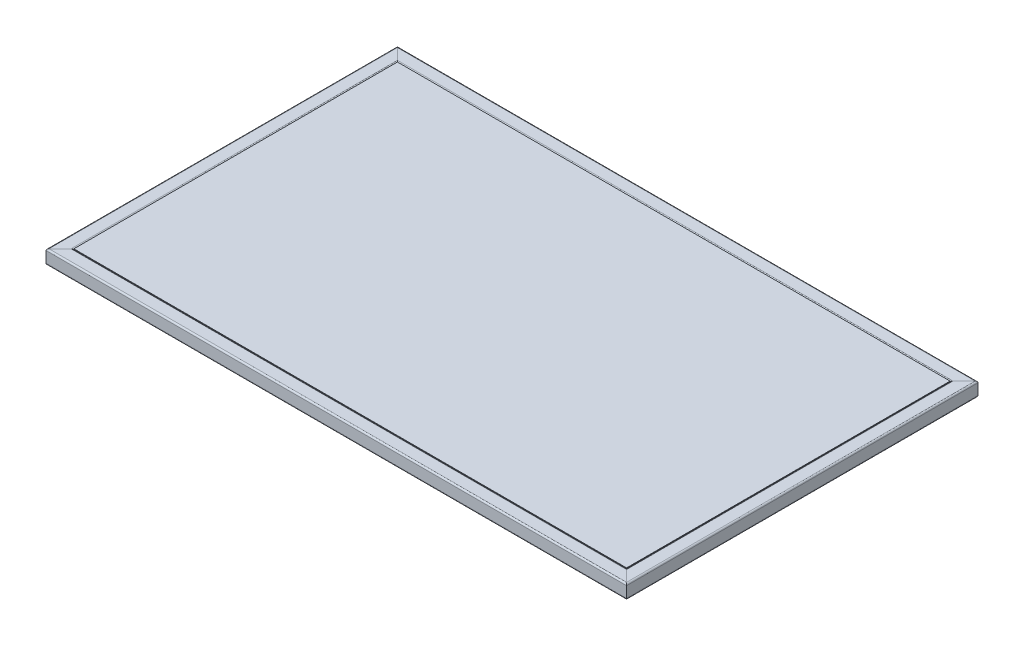
from build123d import *

# Parameters (mm, degrees)
TUBO_CUADRADO_2_X_2_X_0_25_1_DEPTH      = 507.940768363
TUBO_CUADRADO_2_X_2_X_0_25_1_DEPTH_BACK = 27.940768363
TUBO_CUADRADO_2_X_2_X_0_25_1_2_DEPTH    = 848.881536726
TUBO_CUADRADO_2_X_2_X_0_25_1_3_DEPTH    = 535.881536726
TUBO_CUADRADO_2_X_2_X_0_25_1_4_DEPTH    = 848.881536726
CROQUIS2_W                              = 754.9
CROQUIS2_H                              = 441.9
SALIENTE_EXTRUIR1_DEPTH                 = 12.7
VACIADO1_T                              = -1.9


with BuildPart() as part:
    # Sketch1 → Tubo cuadrado 2 X 2 X 0.25(1) (new, two sides: drawn at the far end of the back side and taken through both)
    with BuildSketch(Plane(origin=(-386.975, 9.525, -240), x_dir=(1, 0, 0), z_dir=(0, 0, 1)).offset(-TUBO_CUADRADO_2_X_2_X_0_25_1_DEPTH_BACK)):
        with BuildLine():
            Line((-7.525, -9.525), (7.525, -9.525))
            ThreePointArc((7.525, -9.525), (8.939213562, -8.939213562), (9.525, -7.525))
            Line((9.525, -7.525), (9.525, 7.525))
            ThreePointArc((9.525, 7.525), (8.939213562, 8.939213562), (7.525, 9.525))
            Line((7.525, 9.525), (-7.525, 9.525))
            ThreePointArc((-7.525, 9.525), (-8.939213562, 8.939213562), (-9.525, 7.525))
            Line((-9.525, 7.525), (-9.525, -7.525))
            ThreePointArc((-9.525, -7.525), (-8.939213562, -8.939213562), (-7.525, -9.525))
        make_face()
        with BuildLine():
            Line((-7.525, -8.525), (7.525, -8.525))
            ThreePointArc((7.525, -8.525), (8.232106781, -8.232106781), (8.525, -7.525))
            Line((8.525, -7.525), (8.525, 7.525))
            ThreePointArc((8.525, 7.525), (8.232106781, 8.232106781), (7.525, 8.525))
            Line((7.525, 8.525), (-7.525, 8.525))
            ThreePointArc((-7.525, 8.525), (-8.232106781, 8.232106781), (-8.525, 7.525))
            Line((-8.525, 7.525), (-8.525, -7.525))
            ThreePointArc((-8.525, -7.525), (-8.232106781, -8.232106781), (-7.525, -8.525))
        make_face(mode=Mode.SUBTRACT)
    extrude(amount=TUBO_CUADRADO_2_X_2_X_0_25_1_DEPTH + TUBO_CUADRADO_2_X_2_X_0_25_1_DEPTH_BACK)

    # Tubo cuadrado 2 X 2 X 0.25(1) mitre 1
    split(bisect_by=Plane(origin=(-396.5, 0, -240), x_dir=(0, -1, 0), z_dir=(-0.707106781, 0, 0.707106781)), keep=Keep.TOP)

    # Tubo cuadrado 2 X 2 X 0.25(1) mitre 2
    split(bisect_by=Plane(origin=(-396.5, 0, 240), x_dir=(0, -1, 0), z_dir=(-0.707106781, 0, -0.707106781)), keep=Keep.TOP)


with BuildPart() as body_2:
    # Sketch1 on segment 2 (carried to segment 2) → Tubo cuadrado 2 X 2 X 0.25_1 2 (new body)
    with BuildSketch(Plane(origin=(-424.440768363, 9.525, 230.475), x_dir=(0, 0, -1), z_dir=(1, 0, 0))):
        with BuildLine():
            Line((-7.525, -9.525), (7.525, -9.525))
            ThreePointArc((7.525, -9.525), (8.939213562, -8.939213562), (9.525, -7.525))
            Line((9.525, -7.525), (9.525, 7.525))
            ThreePointArc((9.525, 7.525), (8.939213562, 8.939213562), (7.525, 9.525))
            Line((7.525, 9.525), (-7.525, 9.525))
            ThreePointArc((-7.525, 9.525), (-8.939213562, 8.939213562), (-9.525, 7.525))
            Line((-9.525, 7.525), (-9.525, -7.525))
            ThreePointArc((-9.525, -7.525), (-8.939213562, -8.939213562), (-7.525, -9.525))
        make_face()
        with BuildLine():
            Line((-7.525, -8.525), (7.525, -8.525))
            ThreePointArc((7.525, -8.525), (8.232106781, -8.232106781), (8.525, -7.525))
            Line((8.525, -7.525), (8.525, 7.525))
            ThreePointArc((8.525, 7.525), (8.232106781, 8.232106781), (7.525, 8.525))
            Line((7.525, 8.525), (-7.525, 8.525))
            ThreePointArc((-7.525, 8.525), (-8.232106781, 8.232106781), (-8.525, 7.525))
            Line((-8.525, 7.525), (-8.525, -7.525))
            ThreePointArc((-8.525, -7.525), (-8.232106781, -8.232106781), (-7.525, -8.525))
        make_face(mode=Mode.SUBTRACT)
    extrude(amount=TUBO_CUADRADO_2_X_2_X_0_25_1_2_DEPTH)

    # Tubo cuadrado 2 X 2 X 0.25_1 2 mitre 1
    split(bisect_by=Plane(origin=(-396.5, 0, 240), x_dir=(0, 1, 0), z_dir=(0.707106781, 0, 0.707106781)), keep=Keep.TOP)

    # Tubo cuadrado 2 X 2 X 0.25_1 2 mitre 2
    split(bisect_by=Plane(origin=(396.5, 0, 240), x_dir=(0, -1, 0), z_dir=(-0.707106781, 0, 0.707106781)), keep=Keep.TOP)


with BuildPart() as body_3:
    # Sketch1 on segment 3 (carried to segment 3) → Tubo cuadrado 2 X 2 X 0.25_1 3 (new body)
    with BuildSketch(Plane(origin=(386.975, 9.525, 267.940768363), x_dir=(-1, 0, 0), z_dir=(0, 0, -1))):
        with BuildLine():
            Line((-7.525, -9.525), (7.525, -9.525))
            ThreePointArc((7.525, -9.525), (8.939213562, -8.939213562), (9.525, -7.525))
            Line((9.525, -7.525), (9.525, 7.525))
            ThreePointArc((9.525, 7.525), (8.939213562, 8.939213562), (7.525, 9.525))
            Line((7.525, 9.525), (-7.525, 9.525))
            ThreePointArc((-7.525, 9.525), (-8.939213562, 8.939213562), (-9.525, 7.525))
            Line((-9.525, 7.525), (-9.525, -7.525))
            ThreePointArc((-9.525, -7.525), (-8.939213562, -8.939213562), (-7.525, -9.525))
        make_face()
        with BuildLine():
            Line((-7.525, -8.525), (7.525, -8.525))
            ThreePointArc((7.525, -8.525), (8.232106781, -8.232106781), (8.525, -7.525))
            Line((8.525, -7.525), (8.525, 7.525))
            ThreePointArc((8.525, 7.525), (8.232106781, 8.232106781), (7.525, 8.525))
            Line((7.525, 8.525), (-7.525, 8.525))
            ThreePointArc((-7.525, 8.525), (-8.232106781, 8.232106781), (-8.525, 7.525))
            Line((-8.525, 7.525), (-8.525, -7.525))
            ThreePointArc((-8.525, -7.525), (-8.232106781, -8.232106781), (-7.525, -8.525))
        make_face(mode=Mode.SUBTRACT)
    extrude(amount=TUBO_CUADRADO_2_X_2_X_0_25_1_3_DEPTH)

    # Tubo cuadrado 2 X 2 X 0.25_1 3 mitre 1
    split(bisect_by=Plane(origin=(396.5, 0, -240), x_dir=(0, 1, 0), z_dir=(0.707106781, 0, 0.707106781)), keep=Keep.TOP)

    # Tubo cuadrado 2 X 2 X 0.25_1 3 mitre 2
    split(bisect_by=Plane(origin=(396.5, 0, 240), x_dir=(0, 1, 0), z_dir=(0.707106781, 0, -0.707106781)), keep=Keep.TOP)


with BuildPart() as body_4:
    # Sketch1 on segment 4 (carried to segment 4) → Tubo cuadrado 2 X 2 X 0.25_1 4 (new body)
    with BuildSketch(Plane(origin=(424.440768363, 9.525, -230.475), x_dir=(0, 0, 1), z_dir=(-1, 0, 0))):
        with BuildLine():
            Line((-7.525, -9.525), (7.525, -9.525))
            ThreePointArc((7.525, -9.525), (8.939213562, -8.939213562), (9.525, -7.525))
            Line((9.525, -7.525), (9.525, 7.525))
            ThreePointArc((9.525, 7.525), (8.939213562, 8.939213562), (7.525, 9.525))
            Line((7.525, 9.525), (-7.525, 9.525))
            ThreePointArc((-7.525, 9.525), (-8.939213562, 8.939213562), (-9.525, 7.525))
            Line((-9.525, 7.525), (-9.525, -7.525))
            ThreePointArc((-9.525, -7.525), (-8.939213562, -8.939213562), (-7.525, -9.525))
        make_face()
        with BuildLine():
            Line((-7.525, -8.525), (7.525, -8.525))
            ThreePointArc((7.525, -8.525), (8.232106781, -8.232106781), (8.525, -7.525))
            Line((8.525, -7.525), (8.525, 7.525))
            ThreePointArc((8.525, 7.525), (8.232106781, 8.232106781), (7.525, 8.525))
            Line((7.525, 8.525), (-7.525, 8.525))
            ThreePointArc((-7.525, 8.525), (-8.232106781, 8.232106781), (-8.525, 7.525))
            Line((-8.525, 7.525), (-8.525, -7.525))
            ThreePointArc((-8.525, -7.525), (-8.232106781, -8.232106781), (-7.525, -8.525))
        make_face(mode=Mode.SUBTRACT)
    extrude(amount=TUBO_CUADRADO_2_X_2_X_0_25_1_4_DEPTH)

    # Tubo cuadrado 2 X 2 X 0.25_1 4 mitre 1
    split(bisect_by=Plane(origin=(-396.5, 0, -240), x_dir=(0, 1, 0), z_dir=(0.707106781, 0, -0.707106781)), keep=Keep.TOP)

    # Tubo cuadrado 2 X 2 X 0.25_1 4 mitre 2
    split(bisect_by=Plane(origin=(396.5, 0, -240), x_dir=(0, -1, 0), z_dir=(-0.707106781, 0, -0.707106781)), keep=Keep.TOP)


with BuildPart() as body_5:
    # Croquis2 → Saliente-Extruir1 (new body)
    with BuildSketch(Plane(origin=(0, 19.05, 0), x_dir=(1, 0, 0), z_dir=(0, 1, 0))):
        Rectangle(CROQUIS2_W, CROQUIS2_H)
    extrude(amount=-SALIENTE_EXTRUIR1_DEPTH)

    # Vaciado1
    vaciado1_openings = [body_5.faces().sort_by_distance(p)[0] for p in [
        (0, 6.35, 0),
    ]]
    offset(amount=VACIADO1_T, openings=vaciado1_openings, kind=Kind.INTERSECTION)


solid = Compound([part.part, body_2.part, body_3.part, body_4.part, body_5.part])
